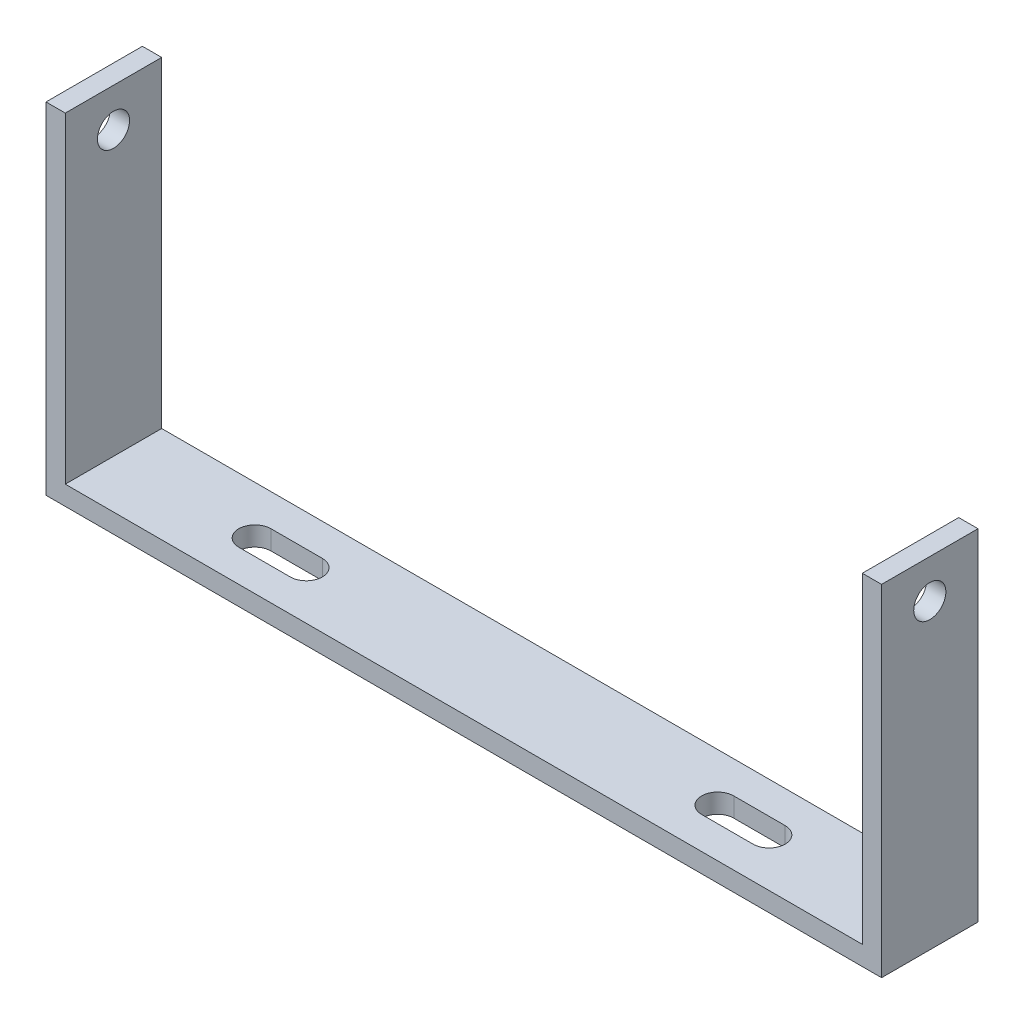
from build123d import *

# Parameters (mm, degrees)
SKETCH_3_W          = 130
SKETCH_3_H          = 15
EXTRUDE_1_DEPTH     = 3
CUT_EXTRUDE_1_DEPTH = 35
SKETCH_5_W          = 3
SKETCH_5_H          = 15
EXTRUDE_2_DEPTH     = 50
SKETCH_6_R          = 2.5
CUT_EXTRUDE_2_DEPTH = 160


with BuildPart() as part:
    # 草图3 → 凸台-拉伸1 (new body)
    with BuildSketch(Plane(origin=(0, 0, 0), x_dir=(1, 0, 0), z_dir=(0, 1, 0))):
        Rectangle(SKETCH_3_W, SKETCH_3_H)
    extrude(amount=EXTRUDE_1_DEPTH)

    # 草图4 → 切除-拉伸1 (cut)
    with BuildSketch(Plane(origin=(0, 3, 0), x_dir=(1, 0, 0), z_dir=(0, 1, 0))):
        with BuildLine():
            Line((-40, 2.5), (-32, 2.5))
            ThreePointArc((-32, 2.5), (-29.5, 0), (-32, -2.5))
            Line((-32, -2.5), (-40, -2.5))
            ThreePointArc((-40, -2.5), (-42.5, 0), (-40, 2.5))
        make_face()
        with BuildLine():
            Line((40, -2.5), (32, -2.5))
            ThreePointArc((32, -2.5), (29.5, 0), (32, 2.5))
            Line((32, 2.5), (40, 2.5))
            ThreePointArc((40, 2.5), (42.5, 0), (40, -2.5))
        make_face()
    extrude(amount=-CUT_EXTRUDE_1_DEPTH, mode=Mode.SUBTRACT)

    # 草图5 → 凸台-拉伸2 (add)
    with BuildSketch(Plane(origin=(0, 3, 0), x_dir=(1, 0, 0), z_dir=(0, 1, 0))):
        with Locations((-63.5, 0)):
            Rectangle(SKETCH_5_W, SKETCH_5_H)
        with Locations((63.5, 0)):
            Rectangle(SKETCH_5_W, SKETCH_5_H)
    extrude(amount=EXTRUDE_2_DEPTH)

    # 草图6 → 切除-拉伸2 (cut)
    with BuildSketch(Plane.ZY.offset(65)):
        with Locations((0, 47)):
            Circle(SKETCH_6_R)
    extrude(amount=-CUT_EXTRUDE_2_DEPTH, mode=Mode.SUBTRACT)


solid = part.part
